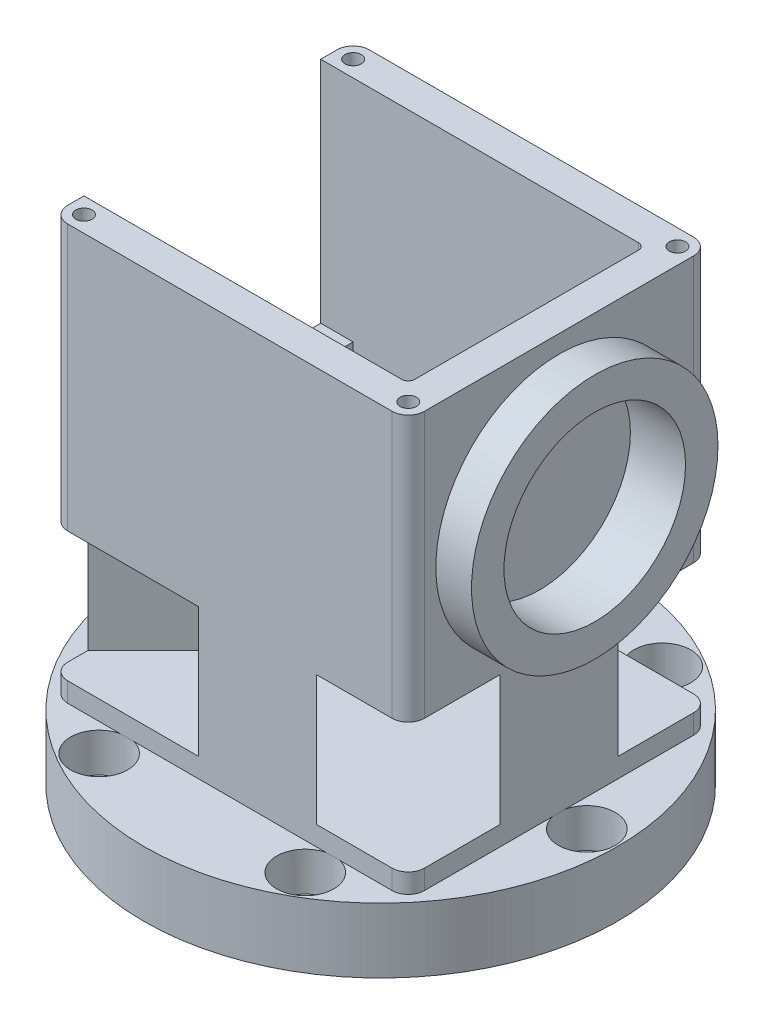
from build123d import *

# Parameters (mm, degrees)
SKETCH1_W             = 45
SKETCH1_H             = 36.5
BOSS_EXTRUDE1_DEPTH   = 10
SKETCH1_R             = 36.5
SKETCH1_R_2           = 2.25
SKETCH1_W_2           = 55
SKETCH1_H_2           = 46.5
BOSS_EXTRUDE1_2_DEPTH = 10
SKETCH1_2_W           = 55
SKETCH1_2_H           = 46.5
SKETCH1_2_W_2         = 45
SKETCH1_2_H_2         = 36.5
BOSS_EXTRUDE2_DEPTH   = 60
FILLET2_R             = 1
CUT_EXTRUDE1_START    = -5
SKETCH2_W             = 36.5
SKETCH2_H             = 50
CUT_EXTRUDE1_DEPTH    = 6
BOSS_EXTRUDE3_START   = -5
SKETCH3_W             = 46.5
SKETCH3_H             = 13.75
BOSS_EXTRUDE3_DEPTH   = 5
FILLET5_R             = 2.5
SKETCH6_R             = 4.4
CUT_EXTRUDE4_DEPTH    = 6
SKETCH7_R             = 19
SKETCH7_R_2           = 14
BOSS_EXTRUDE4_DEPTH   = 5.5
SKETCH7_2_R           = 14
CUT_EXTRUDE5_DEPTH    = 3
SKETCH8_R             = 1.25
CUT_EXTRUDE6_DEPTH    = 11
SKETCH9_R             = 1.25
CUT_EXTRUDE7_DEPTH    = 1
SKETCH11_W            = 45
SKETCH11_H            = 36.5
BOSS_EXTRUDE5_DEPTH   = 15
SKETCH12_W            = 5
SKETCH12_H            = 36.5
BOSS_EXTRUDE6_DEPTH   = 15
BOSS_EXTRUDE7_START   = 15
SKETCH13_R            = 1.25
BOSS_EXTRUDE7_DEPTH   = 15
CUT_EXTRUDE8_DEPTH    = 3
SKETCH15_W            = 20
SKETCH15_H            = 20
CUT_EXTRUDE9_DEPTH    = 114.850371766


with BuildPart() as part:
    # Sketch1 → Boss-Extrude1 (new body)
    with BuildSketch(Plane(origin=(0, 0, 0), x_dir=(1, 0, 0), z_dir=(0, 1, 0))):
        Rectangle(SKETCH1_W, SKETCH1_H)
    extrude(amount=BOSS_EXTRUDE1_DEPTH)



with BuildPart() as body_2:
    # Sketch1 → Boss-Extrude1 2 (new body)
    with BuildSketch(Plane(origin=(0, 0, 0), x_dir=(1, 0, 0), z_dir=(0, 1, 0))):
        with Locations(Location((0, 0, 0), (0, 0, 270))):
            Circle(SKETCH1_R)
        with Locations(Location((-15.89, -27.522287332, 0), (0, 0, 270))):
            Circle(SKETCH1_R_2, mode=Mode.SUBTRACT)
        with Locations(Location((15.89, -27.522287332, 0), (0, 0, 270))):
            Circle(SKETCH1_R_2, mode=Mode.SUBTRACT)
        with Locations(Location((-31.78, 0, 0), (0, 0, 270))):
            Circle(SKETCH1_R_2, mode=Mode.SUBTRACT)
        with Locations(Location((-15.89, 27.522287332, 0), (0, 0, 270))):
            Circle(SKETCH1_R_2, mode=Mode.SUBTRACT)
        Rectangle(SKETCH1_W_2, SKETCH1_H_2, mode=Mode.SUBTRACT)
        with Locations(Location((31.78, 0, 0), (0, 0, 270))):
            Circle(SKETCH1_R_2, mode=Mode.SUBTRACT)
        with Locations(Location((15.89, 27.522287332, 0), (0, 0, 270))):
            Circle(SKETCH1_R_2, mode=Mode.SUBTRACT)
    extrude(amount=BOSS_EXTRUDE1_2_DEPTH)

    # Sketch1<2> → Boss-Extrude2 (add)
    with BuildSketch(Plane(origin=(0, 0, 0), x_dir=(1, 0, 0), z_dir=(0, 1, 0))):
        Rectangle(SKETCH1_2_W, SKETCH1_2_H)
        Rectangle(SKETCH1_2_W_2, SKETCH1_2_H_2, mode=Mode.SUBTRACT)
    extrude(amount=BOSS_EXTRUDE2_DEPTH)

    # Fillet2
    fillet2_edges = [body_2.edges().sort_by_distance(p)[0] for p in [
        (-22.5, 30, -18.25),
        (22.5, 30, -18.25),
        (22.5, 30, 18.25),
        (-22.5, 30, 18.25),
    ]]
    fillet(fillet2_edges, radius=FILLET2_R)

    # Sketch2 → Cut-Extrude1 (cut)
    with BuildSketch(Plane(origin=(-22.5, 0, 0), x_dir=(0, 0, -1), z_dir=(1, 0, 0)).offset(CUT_EXTRUDE1_START)):
        with Locations((0, 35)):
            Rectangle(SKETCH2_W, SKETCH2_H)
    extrude(amount=CUT_EXTRUDE1_DEPTH, mode=Mode.SUBTRACT)

    # Sketch3 → Boss-Extrude3 (add)
    with BuildSketch(Plane.ZY.offset(27.5).offset(BOSS_EXTRUDE3_START)):
        with Locations((0, 16.875)):
            Rectangle(SKETCH3_W, SKETCH3_H)
    extrude(amount=BOSS_EXTRUDE3_DEPTH)

    # Fillet5
    fillet5_edges = [body_2.edges().sort_by_distance(p)[0] for p in [
        (27.5, 35, -23.25),
        (-27.5, 35, -23.25),
        (-27.5, 35, 23.25),
        (27.5, 35, 23.25),
    ]]
    fillet(fillet5_edges, radius=FILLET5_R)

    # Sketch6 → Cut-Extrude4 (cut)
    with BuildSketch(Plane(origin=(0, 10, 0), x_dir=(1, 0, 0), z_dir=(0, 1, 0))):
        with Locations(Location((-15.89, 27.522287332, 0), (0, 0, 270))):
            Circle(SKETCH6_R)
        with Locations(Location((15.89, 27.522287332, 0), (0, 0, 270))):
            Circle(SKETCH6_R)
        with Locations(Location((31.78, 0, 0), (0, 0, 270))):
            Circle(SKETCH6_R)
        with Locations(Location((15.89, -27.522287332, 0), (0, 0, 270))):
            Circle(SKETCH6_R)
        with Locations(Location((-15.89, -27.522287332, 0), (0, 0, 270))):
            Circle(SKETCH6_R)
        with Locations(Location((-31.78, 0, 0), (0, 0, 270))):
            Circle(SKETCH6_R)
    extrude(amount=-CUT_EXTRUDE4_DEPTH, mode=Mode.SUBTRACT)

    # Sketch7 → Boss-Extrude4 (add)
    with BuildSketch(Plane(origin=(27.5, 0, 0), x_dir=(0, 0, -1), z_dir=(1, 0, 0))):
        with Locations(Location((0, 52.25, 0), (0, 0, 155.927346102))):
            Circle(SKETCH7_R)
        with Locations(Location((0, 52.25, 0), (0, 0, 146.387625402))):
            Circle(SKETCH7_R_2, mode=Mode.SUBTRACT)
    extrude(amount=BOSS_EXTRUDE4_DEPTH)

    # Sketch7<2> → Cut-Extrude5 (cut)
    with BuildSketch(Plane(origin=(27.5, 0, 0), x_dir=(0, 0, -1), z_dir=(1, 0, 0))):
        with Locations(Location((0, 52.25, 0), (0, 0, 146.387625402))):
            Circle(SKETCH7_2_R)
    extrude(amount=-CUT_EXTRUDE5_DEPTH, mode=Mode.SUBTRACT)

    # Sketch8 → Cut-Extrude6 (cut)
    with BuildSketch(Plane(origin=(0, 60, 0), x_dir=(1, 0, 0), z_dir=(0, 1, 0))):
        with Locations(Location((-25, 20.75, 0), (0, 0, 270))):
            Circle(SKETCH8_R)
        with Locations(Location((25, 20.75, 0), (0, 0, 270))):
            Circle(SKETCH8_R)
        with Locations(Location((25, -20.75, 0), (0, 0, 270))):
            Circle(SKETCH8_R)
        with Locations(Location((-25, -20.75, 0), (0, 0, 270))):
            Circle(SKETCH8_R)
    extrude(amount=-CUT_EXTRUDE6_DEPTH, mode=Mode.SUBTRACT)

    # Sketch9 → Cut-Extrude7 (cut)
    with BuildSketch(Plane(origin=(0, 60, 0), x_dir=(1, 0, 0), z_dir=(0, 1, 0))):
        with BuildLine():
            Line((21.5, -18.25), (-27.5, -18.25))
            Line((-27.5, -18.25), (-27.5, -20.75))
            ThreePointArc((-27.5, -20.75), (-26.767766953, -22.517766953), (-25, -23.25))
            Line((-25, -23.25), (25, -23.25))
            ThreePointArc((25, -23.25), (26.767766953, -22.517766953), (27.5, -20.75))
            Line((27.5, -20.75), (27.5, -17.347550259))
            Line((27.5, -17.347550259), (27.5, -11.659223816))
            Line((27.5, -11.659223816), (24.5, -11.659223816))
            Line((24.5, -11.659223816), (24.5, 11.659223816))
            Line((24.5, 11.659223816), (27.5, 11.659223816))
            Line((27.5, 11.659223816), (27.5, 17.347550259))
            Line((27.5, 17.347550259), (27.5, 20.75))
            ThreePointArc((27.5, 20.75), (26.767766953, 22.517766953), (25, 23.25))
            Line((25, 23.25), (-25, 23.25))
            ThreePointArc((-25, 23.25), (-26.767766953, 22.517766953), (-27.5, 20.75))
            Line((-27.5, 20.75), (-27.5, 18.25))
            Line((-27.5, 18.25), (21.5, 18.25))
            ThreePointArc((21.5, 18.25), (22.207106781, 17.957106781), (22.5, 17.25))
            Line((22.5, 17.25), (22.5, -17.25))
            ThreePointArc((22.5, -17.25), (22.207106781, -17.957106781), (21.5, -18.25))
        make_face()
        with Locations(Location((-25, -20.75, 0), (0, 0, 270))):
            Circle(SKETCH9_R, mode=Mode.SUBTRACT)
        with Locations(Location((25, -20.75, 0), (0, 0, 270))):
            Circle(SKETCH9_R, mode=Mode.SUBTRACT)
        with Locations(Location((25, 20.75, 0), (0, 0, 270))):
            Circle(SKETCH9_R, mode=Mode.SUBTRACT)
        with Locations(Location((-25, 20.75, 0), (0, 0, 270))):
            Circle(SKETCH9_R, mode=Mode.SUBTRACT)
    extrude(amount=-CUT_EXTRUDE7_DEPTH, mode=Mode.SUBTRACT)


with BuildPart() as part_1:
    add(part.part)

    add(body_2.part)  # Boss-Extrude5 merges body 2
    # Sketch11 → Boss-Extrude5 (add)
    with BuildSketch(Plane(origin=(0, 10, 0), x_dir=(1, 0, 0), z_dir=(0, 1, 0))):
        Rectangle(SKETCH11_W, SKETCH11_H)
    extrude(amount=BOSS_EXTRUDE5_DEPTH)

    # Sketch12 → Boss-Extrude6 (add)
    with BuildSketch(Plane(origin=(0, 23.75, 0), x_dir=(1, 0, 0), z_dir=(0, 1, 0))):
        with Locations((-25, 0)):
            Rectangle(SKETCH12_W, SKETCH12_H)
    extrude(amount=BOSS_EXTRUDE6_DEPTH)

    # Sketch13 → Boss-Extrude7 (add)
    with BuildSketch(Plane(origin=(0, 59, 0), x_dir=(1, 0, 0), z_dir=(0, 1, 0)).offset(BOSS_EXTRUDE7_START)):
        with BuildLine():
            Line((27.5, 12.265296572), (27.5, -12.265296572))
            Line((27.5, -12.265296572), (27.5, -17.760560239))
            Line((27.5, -17.760560239), (27.5, -20.75))
            ThreePointArc((27.5, -20.75), (26.767766953, -22.517766953), (25, -23.25))
            Line((25, -23.25), (-25, -23.25))
            ThreePointArc((-25, -23.25), (-26.767766953, -22.517766953), (-27.5, -20.75))
            Line((-27.5, -20.75), (-27.5, -18.25))
            Line((-27.5, -18.25), (21.5, -18.25))
            ThreePointArc((21.5, -18.25), (22.207106781, -17.957106781), (22.5, -17.25))
            Line((22.5, -17.25), (22.5, 17.25))
            ThreePointArc((22.5, 17.25), (22.207106781, 17.957106781), (21.5, 18.25))
            Line((21.5, 18.25), (-27.5, 18.25))
            Line((-27.5, 18.25), (-27.5, 20.75))
            ThreePointArc((-27.5, 20.75), (-26.767766953, 22.517766953), (-25, 23.25))
            Line((-25, 23.25), (25, 23.25))
            ThreePointArc((25, 23.25), (26.767766953, 22.517766953), (27.5, 20.75))
            Line((27.5, 20.75), (27.5, 17.760560239))
            Line((27.5, 17.760560239), (27.5, 12.265296572))
        make_face()
        with Locations(Location((-25, -20.75, 0), (0, 0, 270))):
            Circle(SKETCH13_R, mode=Mode.SUBTRACT)
        with Locations(Location((25, -20.75, 0), (0, 0, 270))):
            Circle(SKETCH13_R, mode=Mode.SUBTRACT)
        with Locations(Location((25, 20.75, 0), (0, 0, 270))):
            Circle(SKETCH13_R, mode=Mode.SUBTRACT)
        with Locations(Location((-25, 20.75, 0), (0, 0, 270))):
            Circle(SKETCH13_R, mode=Mode.SUBTRACT)
    extrude(amount=-BOSS_EXTRUDE7_DEPTH)

    # Sketch14 → Cut-Extrude8 (cut)
    with BuildSketch(Plane(origin=(27.5, 0, 0), x_dir=(0, 0, -1), z_dir=(1, 0, 0))):
        with BuildLine():
            Line((-12.265296572, 59), (12.265296572, 59))
            ThreePointArc((12.265296572, 59), (0, 66.25), (-12.265296572, 59))
        make_face()
    extrude(amount=-CUT_EXTRUDE8_DEPTH, mode=Mode.SUBTRACT)

    # Sketch15 → Cut-Extrude9 (cut, through all)
    with BuildSketch(Plane(origin=(26.767766953, 74, -22.517766953), x_dir=(-0.7071067811865468, 0, -0.7071067811865483), z_dir=(0.7071067811865483, 0, -0.7071067811865468))):
        with Locations((0, -51)):
            Rectangle(SKETCH15_W, SKETCH15_H)
    cut_extrude9 = extrude(amount=-CUT_EXTRUDE9_DEPTH, mode=Mode.SUBTRACT)

    # Mirror1: Cut-Extrude9 across plane
    add(cut_extrude9.mirror(Plane.XY), mode=Mode.SUBTRACT)


solid = part_1.part
